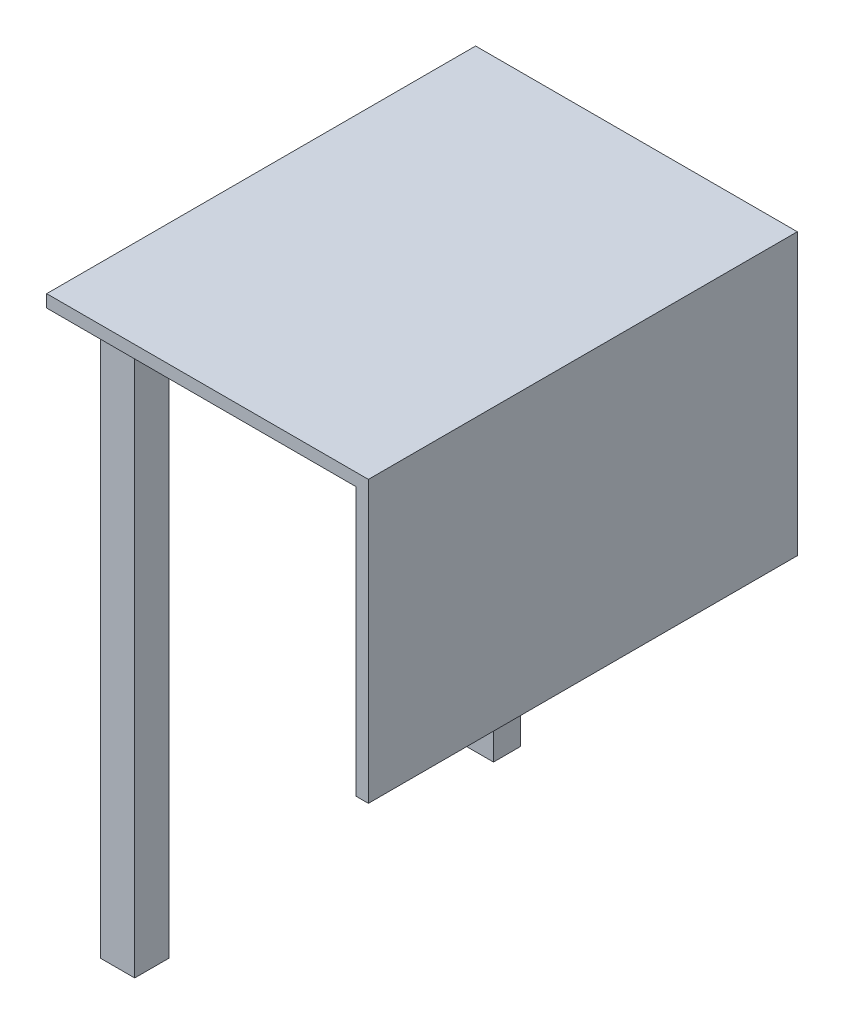
from build123d import *

# Parameters (mm, degrees)
SKETCH2_W                = 457.2
SKETCH2_H                = 609.6
SKETCH2_W_2              = 38.1
SKETCH2_H_2              = 38.1
SKETCH2_W_3              = 48.862926818
SKETCH2_H_3              = 48.862926818
BOSS_EXTRUDE1_DEPTH      = 17.78
SKETCH3_W                = 17.78
SKETCH3_H                = 609.6
BOSS_EXTRUDE2_DEPTH      = 381
BOSS_EXTRUDE3_DEPTH      = 17.78
BOSS_EXTRUDE3_DEPTH_BACK = 787.4
SKETCH4_W                = 38.1
SKETCH4_H                = 38.1
SKETCH4_W_2              = 48.862926818
SKETCH4_H_2              = 48.862926818


with BuildPart() as part:
    # Sketch2 → Boss-Extrude1 (new body)
    with BuildSketch(Plane(origin=(0, 0, 0), x_dir=(1, 0, 0), z_dir=(0, 1, 0))):
        Rectangle(SKETCH2_W, SKETCH2_H)
        with Locations((-158.75, 260.35)):
            Rectangle(SKETCH2_W_2, SKETCH2_H_2, mode=Mode.SUBTRACT)
        with Locations((-153.368536591, -254.968536591)):
            Rectangle(SKETCH2_W_3, SKETCH2_H_3, mode=Mode.SUBTRACT)
    extrude(amount=BOSS_EXTRUDE1_DEPTH)

    # Sketch3 → Boss-Extrude2 (add)
    with BuildSketch(Plane(origin=(0, 0, 0), x_dir=(1, 0, 0), z_dir=(0, 1, 0))):
        with Locations((219.71, 0)):
            Rectangle(SKETCH3_W, SKETCH3_H)
    extrude(amount=-BOSS_EXTRUDE2_DEPTH)

    # Sketch4 → Boss-Extrude3 (add, two sides: drawn at the far end of the back side and taken through both)
    with BuildSketch(Plane(origin=(0, 0, 0), x_dir=(1, 0, 0), z_dir=(0, 1, 0)).offset(-BOSS_EXTRUDE3_DEPTH_BACK)):
        with Locations((-158.75, 260.35)):
            Rectangle(SKETCH4_W, SKETCH4_H)
        with Locations((-153.368536591, -254.968536591)):
            Rectangle(SKETCH4_W_2, SKETCH4_H_2)
    extrude(amount=BOSS_EXTRUDE3_DEPTH + BOSS_EXTRUDE3_DEPTH_BACK)


solid = part.part
